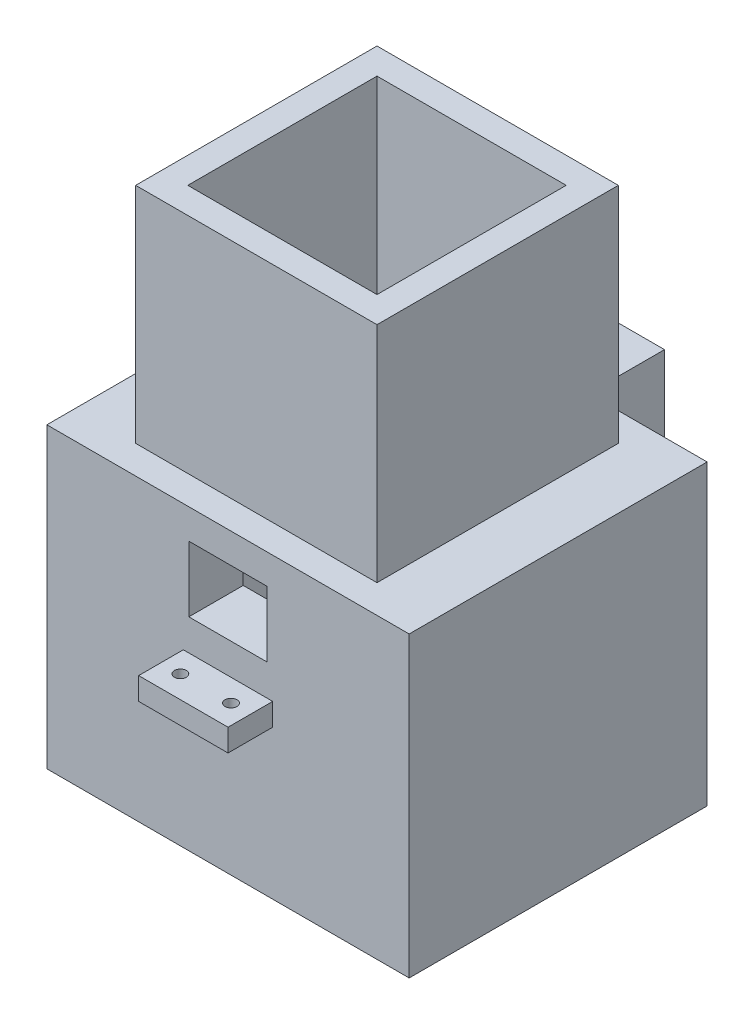
from build123d import *

# Parameters (mm, degrees)
SKETCH_1_W          = 16.2
SKETCH_1_H          = 16.2
SKETCH_1_W_2        = 12.7
SKETCH_1_H_2        = 12.7
EXTRUDE_1_DEPTH     = 35
SKETCH_3_W          = 12.7
SKETCH_3_H          = 12.7
EXTRUDE_2_DEPTH     = 1
SKETCH_5_W          = 24.32
SKETCH_5_H          = 20
SKETCH_5_W_2        = 2.6
SKETCH_5_H_2        = 10.16
SKETCH_5_W_3        = 14.7
SKETCH_5_H_3        = 14.7
EXTRUDE_3_DEPTH     = 20
SKETCH_9_W          = 2.74
SKETCH_9_H          = 10.6
CUT_EXTRUDE_5_DEPTH = 8.7
CUT_EXTRUDE_6_REACH = 44.105
SKETCH_10_W         = 5.26
SKETCH_10_H         = 4.4
SKETCH_11_W         = 6
SKETCH_11_H         = 3
SKETCH_11_R         = 0.4
EXTRUDE_5_DEPTH     = 1.5
SKETCH_13_W         = 8.4
SKETCH_13_H         = 8.4
SKETCH_13_W_2       = 5.6
SKETCH_13_H_2       = 5.6
EXTRUDE_6_DEPTH     = 5.1
CUT_EXTRUDE_7_REACH = 45.61
SKETCH_15_R         = 2.65
SKETCH_16_W         = 8.4
SKETCH_16_H         = 1.6
EXTRUDE_7_DEPTH     = 7.4
CUT_EXTRUDE_8_REACH = 34.342
SKETCH_17_R         = 0.4
EXTRUDE_START       = 3.7
SKETCH_20_W         = 5.6
SKETCH_20_H         = 5.6
SKETCH_20_R         = 2.65
EXTRUDE_8_DEPTH     = 3.7
SKETCH_21_W         = 8.4
SKETCH_21_H         = 1
EXTRUDE_9_DEPTH     = 5.1


with BuildPart() as part:
    # 草圖1 → 填料-伸長1 (new body)
    with BuildSketch(Plane(origin=(0, 0, 0), x_dir=(1, 0, 0), z_dir=(0, 1, 0))):
        Rectangle(SKETCH_1_W, SKETCH_1_H)
        Rectangle(SKETCH_1_W_2, SKETCH_1_H_2, mode=Mode.SUBTRACT)
    extrude(amount=EXTRUDE_1_DEPTH)



with BuildPart() as body_2:
    # 草圖3 → 填料-伸長2 (new body)
    with BuildSketch(Plane(origin=(0, 0, 0), x_dir=(1, 0, 0), z_dir=(0, 1, 0))):
        Rectangle(SKETCH_3_W, SKETCH_3_H)
    extrude(amount=EXTRUDE_2_DEPTH)


with BuildPart() as part_1:
    add(part.part)

    add(body_2.part)  # 填料-伸長3 merges body 2
    # 草圖5 → 填料-伸長3 (add)
    # profile 1 of 3: a face of its own
    with BuildSketch(Plane(origin=(0, 0, 0), x_dir=(1, 0, 0), z_dir=(0, 1, 0))):
        Rectangle(SKETCH_5_W, SKETCH_5_H)
        with Locations((-9.16, 0)):
            Rectangle(SKETCH_5_W_2, SKETCH_5_H_2, mode=Mode.SUBTRACT)
        Rectangle(SKETCH_5_W_3, SKETCH_5_H_3, mode=Mode.SUBTRACT)
        with Locations((9.16, 0)):
            Rectangle(SKETCH_5_W_2, SKETCH_5_H_2, mode=Mode.SUBTRACT)
    # profile 2 of 3: a face of its own
    with BuildSketch(Plane(origin=(0, 0, 0), x_dir=(1, 0, 0), z_dir=(0, 1, 0))):
        with Locations((-9.16, 0)):
            Rectangle(SKETCH_5_W_2, SKETCH_5_H_2)
    # profile 3 of 3: a face of its own
    with BuildSketch(Plane(origin=(0, 0, 0), x_dir=(1, 0, 0), z_dir=(0, 1, 0))):
        with Locations((9.16, 0)):
            Rectangle(SKETCH_5_W_2, SKETCH_5_H_2)
    extrude(amount=EXTRUDE_3_DEPTH)

    # 草圖9 → 除料-伸長5 (cut)
    with BuildSketch(Plane(origin=(0, 0, 0), x_dir=(1, 0, 0), z_dir=(0, 1, 0))):
        with Locations((-8.89, 0)):
            Rectangle(SKETCH_9_W, SKETCH_9_H)
        with Locations((8.89, 0)):
            Rectangle(SKETCH_9_W, SKETCH_9_H)
    extrude(amount=CUT_EXTRUDE_5_DEPTH, mode=Mode.SUBTRACT)

    # 草圖10 → 除料-伸長6 (cut, up to next)
    with BuildSketch(Plane.XY.offset(10), mode=Mode.PRIVATE) as cut_extrude_6_sk1:
        with Locations((0, 15.8)):
            Rectangle(SKETCH_10_W, SKETCH_10_H)
    cut_extrude_6_tool1 = extrude(cut_extrude_6_sk1.sketch, amount=-CUT_EXTRUDE_6_REACH, mode=Mode.PRIVATE) & part_1.part
    add(cut_extrude_6_tool1.solids().sort_by_distance((0, 15.8, 10))[0], mode=Mode.SUBTRACT)

    # 草圖11 → 填料-伸長5 (add)
    with BuildSketch(Plane(origin=(0, 10, 0), x_dir=(1, 0, 0), z_dir=(0, 1, 0))):
        with Locations((0, -11.5)):
            Rectangle(SKETCH_11_W, SKETCH_11_H)
        with Locations(Location((-1.7, -11.5, 0), (0, 0, 270))):
            Circle(SKETCH_11_R, mode=Mode.SUBTRACT)
        with Locations(Location((1.7, -11.5, 0), (0, 0, 270))):
            Circle(SKETCH_11_R, mode=Mode.SUBTRACT)
    extrude(amount=EXTRUDE_5_DEPTH)

    # 草圖13 → 填料-伸長6 (add)
    with BuildSketch(Plane(origin=(0, 0, -10), x_dir=(-1, 0, 0), z_dir=(0, 0, -1))):
        with Locations((0, 15.8)):
            Rectangle(SKETCH_13_W, SKETCH_13_H)
        with Locations((0, 15.8)):
            Rectangle(SKETCH_13_W_2, SKETCH_13_H_2, mode=Mode.SUBTRACT)
    extrude(amount=EXTRUDE_6_DEPTH)

    # 草圖15 → 除料-伸長7 (cut, up to next)
    with BuildSketch(Plane(origin=(0, 0, -10), x_dir=(-1, 0, 0), z_dir=(0, 0, -1)), mode=Mode.PRIVATE) as cut_extrude_7_sk1:
        with Locations((0, 15.8)):
            Circle(SKETCH_15_R)
    cut_extrude_7_tool1 = extrude(cut_extrude_7_sk1.sketch, amount=-CUT_EXTRUDE_7_REACH, mode=Mode.PRIVATE) & part_1.part
    add(cut_extrude_7_tool1.solids().sort_by_distance((0, 15.8, -10))[0], mode=Mode.SUBTRACT)

    # 草圖16 → 填料-伸長7 (add)
    with BuildSketch(Plane(origin=(0, 0, -10), x_dir=(-1, 0, 0), z_dir=(0, 0, -1))):
        with Locations((0, 9.8)):
            Rectangle(SKETCH_16_W, SKETCH_16_H)
    extrude(amount=EXTRUDE_7_DEPTH)

    # 草圖17 → 除料-伸長8 (cut, up to next)
    with BuildSketch(Plane(origin=(0, 10.6, 0), x_dir=(1, 0, 0), z_dir=(0, 1, 0)), mode=Mode.PRIVATE) as cut_extrude_8_sk1:
        with Locations(Location((1.27, 16.15, 0), (0, 0, 270))):
            Circle(SKETCH_17_R)
    cut_extrude_8_tool1 = extrude(cut_extrude_8_sk1.sketch, amount=-CUT_EXTRUDE_8_REACH, mode=Mode.PRIVATE) & part_1.part
    # 草圖17 → 除料-伸長8 (cut, up to next)
    with BuildSketch(Plane(origin=(0, 10.6, 0), x_dir=(1, 0, 0), z_dir=(0, 1, 0)), mode=Mode.PRIVATE) as cut_extrude_8_sk2:
        with Locations(Location((-1.27, 16.15, 0), (0, 0, 270))):
            Circle(SKETCH_17_R)
    cut_extrude_8_tool2 = extrude(cut_extrude_8_sk2.sketch, amount=-CUT_EXTRUDE_8_REACH, mode=Mode.PRIVATE) & part_1.part
    add(cut_extrude_8_tool1.solids().sort_by_distance((1.27, 10.6, -16.15))[0], mode=Mode.SUBTRACT)
    add(cut_extrude_8_tool2.solids().sort_by_distance((-1.27, 10.6, -16.15))[0], mode=Mode.SUBTRACT)

    # 草圖20 → 填料-伸長8 (add)
    with BuildSketch(Plane(origin=(0, 0, -10), x_dir=(-1, 0, 0), z_dir=(0, 0, -1)).offset(EXTRUDE_START)):
        with Locations((0, 15.8)):
            Rectangle(SKETCH_20_W, SKETCH_20_H)
        with Locations((0, 15.8)):
            Circle(SKETCH_20_R, mode=Mode.SUBTRACT)
    extrude(amount=-EXTRUDE_8_DEPTH)

    # 草圖21 → 填料-伸長9 (add)
    with BuildSketch(Plane(origin=(0, 0, -10), x_dir=(-1, 0, 0), z_dir=(0, 0, -1))):
        with Locations((0, 11.1)):
            Rectangle(SKETCH_21_W, SKETCH_21_H)
    extrude(amount=EXTRUDE_9_DEPTH)


solid = part_1.part
